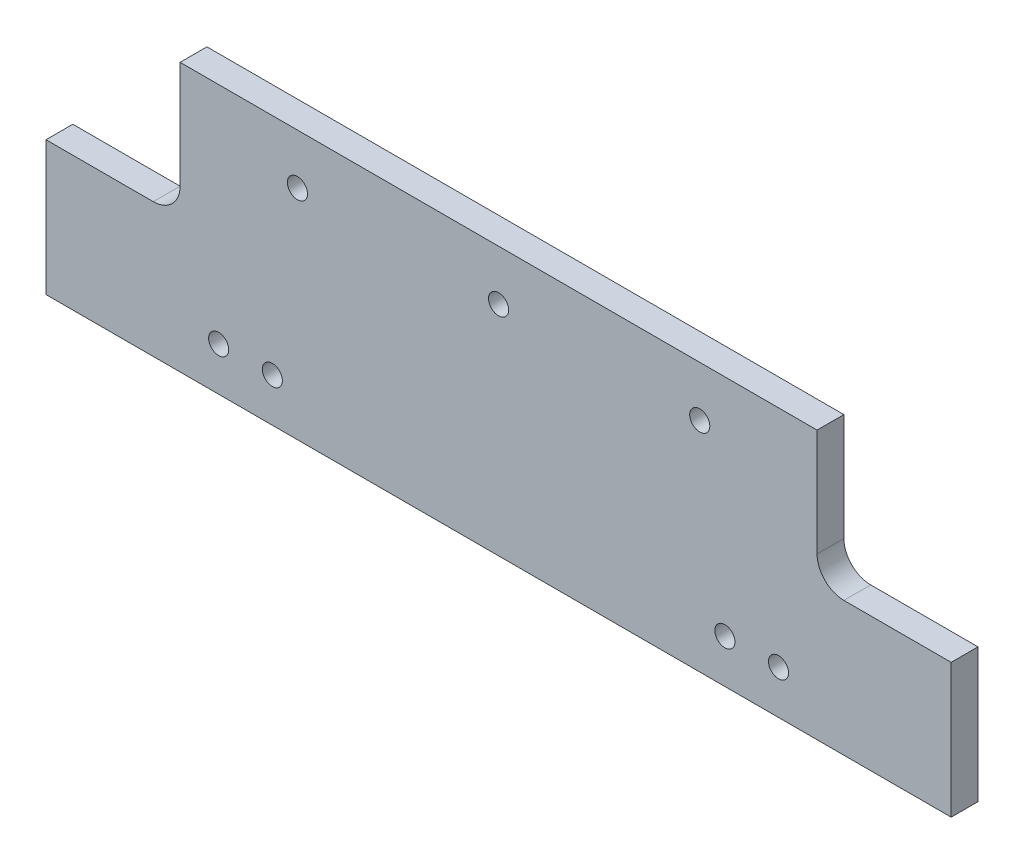
from build123d import *

# Parameters (mm, degrees)
SKETCH_1_W          = 135
SKETCH_1_H          = 40
EXTRUDE_1_DEPTH     = 4
SKETCH_2_W          = 20
SKETCH_2_H          = 20
CUT_EXTRUDE_1_DEPTH = 71.514182971
FILLET_1_R          = 4
SKETCH_3_R          = 1.5
CUT_EXTRUDE_2_DEPTH = 71.514182971
SKETCH_4_R          = 1.5
CUT_EXTRUDE_3_DEPTH = 71.514182971


with BuildPart() as part:
    # 草图1 → 凸台-拉伸1 (new body)
    with BuildSketch(Plane.XY):
        Rectangle(SKETCH_1_W, SKETCH_1_H)
    extrude(amount=EXTRUDE_1_DEPTH)

    # 草图2 → 切除-拉伸1 (cut, through all)
    with BuildSketch(Plane.XY.offset(4)):
        with Locations((-57.5, 10)):
            Rectangle(SKETCH_2_W, SKETCH_2_H)
        with Locations((57.5, 10)):
            Rectangle(SKETCH_2_W, SKETCH_2_H)
    extrude(amount=-CUT_EXTRUDE_1_DEPTH, mode=Mode.SUBTRACT)

    # 圆角1
    fillet_1_edges = [part.edges().sort_by_distance(p)[0] for p in [
        (-47.5, 0, 2),
        (47.5, 0, 2),
    ]]
    fillet(fillet_1_edges, radius=FILLET_1_R)

    # 草图3 → 切除-拉伸2 (cut, through all)
    with BuildSketch(Plane.XY.offset(4)):
        with Locations((0, 12.5)):
            Circle(SKETCH_3_R)
        with Locations((-30, 12.5)):
            Circle(SKETCH_3_R)
        with Locations(Location((30, 12.5, 0), (0, 0, 180))):
            Circle(SKETCH_3_R)
    extrude(amount=-CUT_EXTRUDE_2_DEPTH, mode=Mode.SUBTRACT)

    # 草图4 → 切除-拉伸3 (cut, through all)
    with BuildSketch(Plane.XY.offset(4)):
        with Locations((-41.75, -13.5)):
            Circle(SKETCH_4_R)
        with Locations((-33.75, -13.5)):
            Circle(SKETCH_4_R)
        with Locations(Location((33.75, -13.5, 0), (0, 0, 180))):
            Circle(SKETCH_4_R)
        with Locations(Location((41.75, -13.5, 0), (0, 0, 180))):
            Circle(SKETCH_4_R)
    extrude(amount=-CUT_EXTRUDE_3_DEPTH, mode=Mode.SUBTRACT)


solid = part.part
